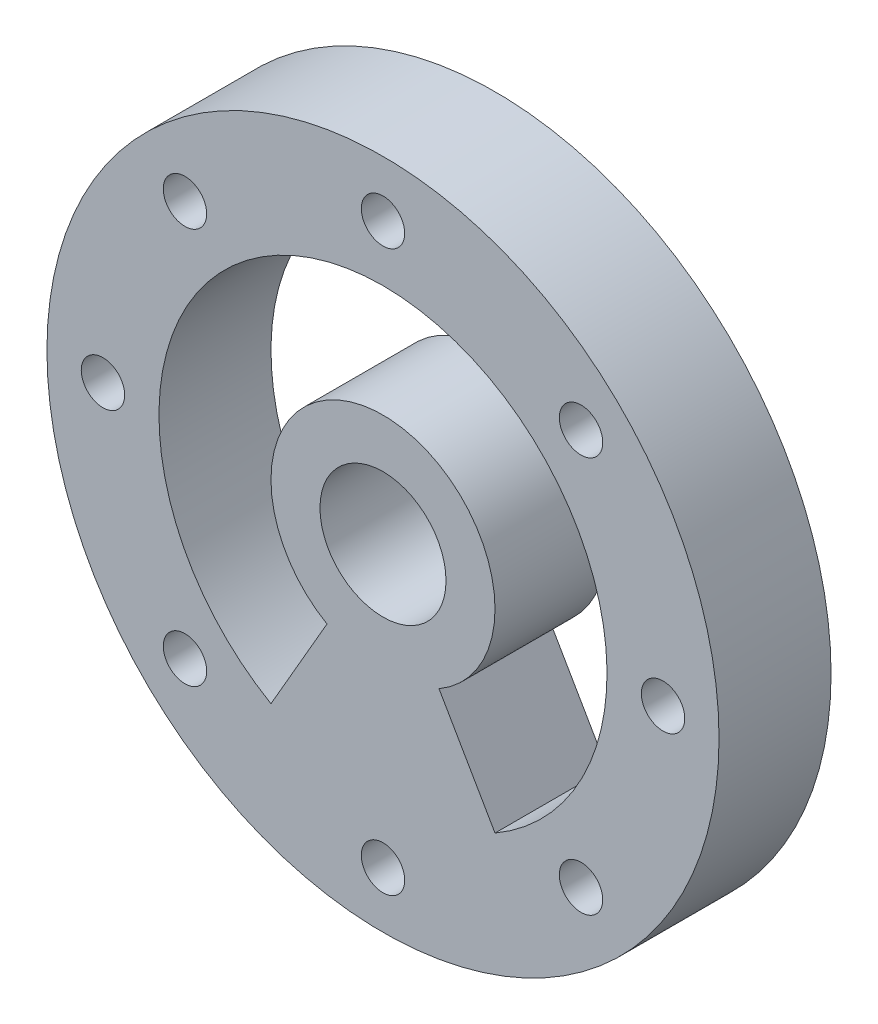
from build123d import *

# Parameters (mm, degrees)
SKETCH6_R           = 24
BOSS_EXTRUDE1_DEPTH = 8
CUT_EXTRUDE4_DEPTH  = 8
SKETCH7_R           = 4.5
CUT_EXTRUDE5_DEPTH  = 8
SKETCH8_R           = 1.55
CUT_EXTRUDE6_DEPTH  = 8


with BuildPart() as part:
    # Sketch6 → Boss-Extrude1 (new body)
    with BuildSketch(Plane.XY):
        Circle(SKETCH6_R)
    extrude(amount=BOSS_EXTRUDE1_DEPTH)

    # Sketch4 → Cut-Extrude4 (cut)
    with BuildSketch(Plane.XY):
        with BuildLine():
            Line((-4, -6.92820323), (-8, -13.856406461))
            ThreePointArc((-8, -13.856406461), (0, 16), (8, -13.856406461))
            Line((8, -13.856406461), (4, -6.92820323))
            ThreePointArc((4, -6.92820323), (0, 8), (-4, -6.92820323))
        make_face()
    extrude(amount=CUT_EXTRUDE4_DEPTH, mode=Mode.SUBTRACT)

    # Sketch7 → Cut-Extrude5 (cut)
    with BuildSketch(Plane(origin=(0, 0, 0), x_dir=(-1, 0, 0), z_dir=(0, 0, -1))):
        Circle(SKETCH7_R)
    extrude(amount=-CUT_EXTRUDE5_DEPTH, mode=Mode.SUBTRACT)

    # Sketch8 → Cut-Extrude6 (cut)
    with BuildSketch(Plane(origin=(0, 0, 0), x_dir=(-1, 0, 0), z_dir=(0, 0, -1))):
        with Locations((0, 20)):
            Circle(SKETCH8_R)
        with Locations((14.142135624, 14.142135624)):
            Circle(SKETCH8_R)
        with Locations((20, 0)):
            Circle(SKETCH8_R)
        with Locations((14.142135624, -14.142135624)):
            Circle(SKETCH8_R)
        with Locations((0, -20)):
            Circle(SKETCH8_R)
        with Locations((-14.142135624, -14.142135624)):
            Circle(SKETCH8_R)
        with Locations((-20, 0)):
            Circle(SKETCH8_R)
        with Locations((-14.142135624, 14.142135624)):
            Circle(SKETCH8_R)
    extrude(amount=-CUT_EXTRUDE6_DEPTH, mode=Mode.SUBTRACT)


solid = part.part
